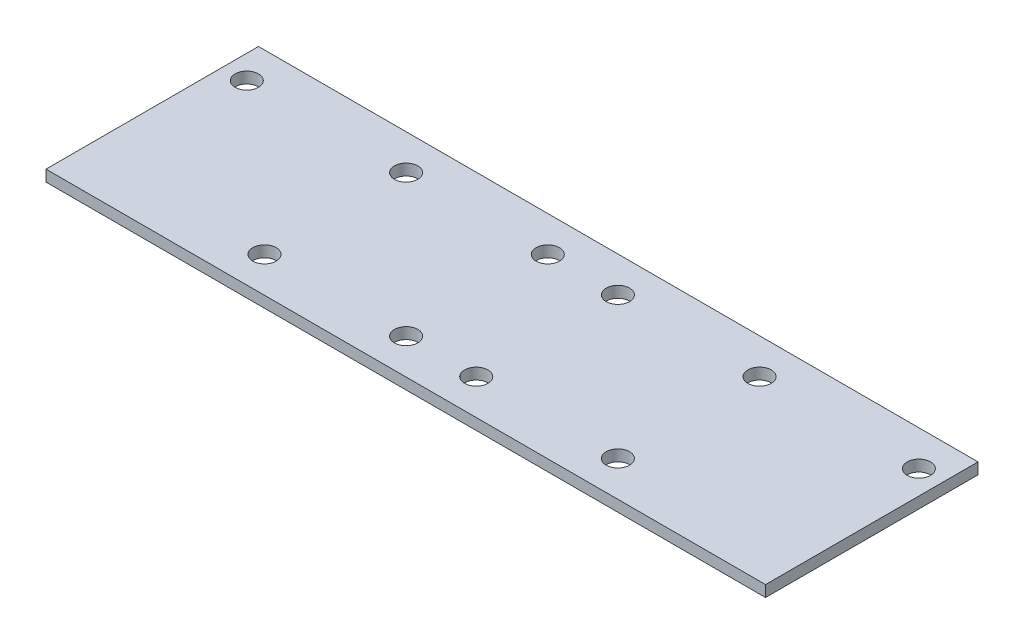
from build123d import *

# Parameters (mm, degrees)
SKETCH1_W           = 203.2
SKETCH1_H           = 60
SKETCH1_R           = 3.3
BOSS_EXTRUDE1_DEPTH = 3.175


with BuildPart() as part:
    # Sketch1 → Boss-Extrude1 (new body)
    with BuildSketch(Plane(origin=(0, 0, 0), x_dir=(1, 0, 0), z_dir=(0, 1, 0))):
        Rectangle(SKETCH1_W, SKETCH1_H)
        with Locations(Location((-49.9, 20, 0), (0, 0, 270))):
            Circle(SKETCH1_R, mode=Mode.SUBTRACT)
        with Locations(Location((-9.9, 20, 0), (0, 0, 270))):
            Circle(SKETCH1_R, mode=Mode.SUBTRACT)
        with Locations(Location((-9.9, -20, 0), (0, 0, 90))):
            Circle(SKETCH1_R, mode=Mode.SUBTRACT)
        with Locations(Location((-49.9, -20, 0), (0, 0, 90))):
            Circle(SKETCH1_R, mode=Mode.SUBTRACT)
        with Locations(Location((-94.9, 20, 0), (0, 0, 270))):
            Circle(SKETCH1_R, mode=Mode.SUBTRACT)
        with Locations(Location((94.9, 20, 0), (0, 0, 90))):
            Circle(SKETCH1_R, mode=Mode.SUBTRACT)
        with Locations(Location((49.9, -20, 0), (0, 0, 270))):
            Circle(SKETCH1_R, mode=Mode.SUBTRACT)
        with Locations(Location((9.9, -20, 0), (0, 0, 270))):
            Circle(SKETCH1_R, mode=Mode.SUBTRACT)
        with Locations(Location((9.9, 20, 0), (0, 0, 90))):
            Circle(SKETCH1_R, mode=Mode.SUBTRACT)
        with Locations(Location((49.9, 20, 0), (0, 0, 90))):
            Circle(SKETCH1_R, mode=Mode.SUBTRACT)
    extrude(amount=BOSS_EXTRUDE1_DEPTH)


solid = part.part
